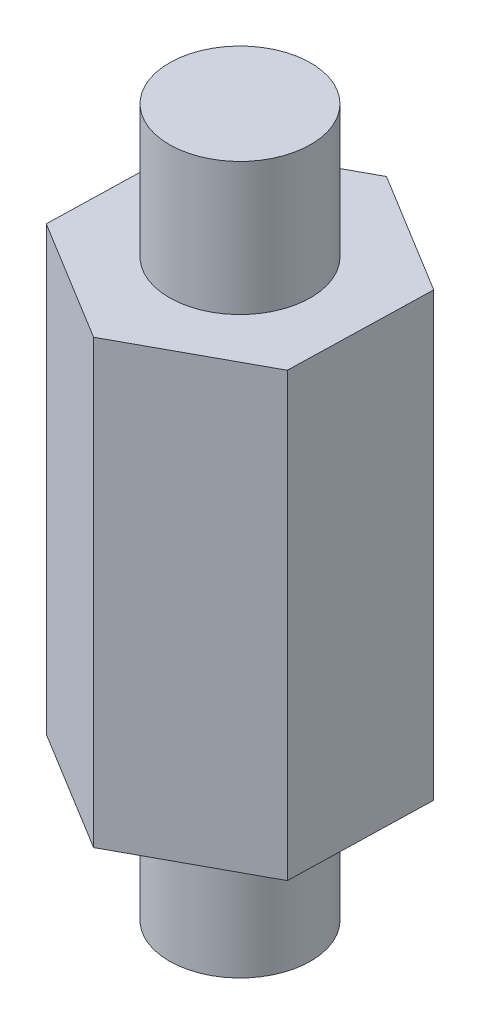
from build123d import *

# Parameters (mm, degrees)
SKETCH_1_R      = 1.6
EXTRUDE_1_DEPTH = 3
EXTRUDE_2_DEPTH = 10
SKETCH_3_R      = 1.6
EXTRUDE_3_DEPTH = 3


with BuildPart() as part:
    # 草图1 → 凸台-拉伸1 (new body)
    with BuildSketch(Plane(origin=(0, 0, 0), x_dir=(1, 0, 0), z_dir=(0, 1, 0))):
        with Locations(Location((0, 0, 0), (0, 0, 270))):
            Circle(SKETCH_1_R)
    extrude(amount=EXTRUDE_1_DEPTH)

    # 草图2 → 凸台-拉伸2 (add)
    with BuildSketch(Plane(origin=(0, 3, 0), x_dir=(1, 0, 0), z_dir=(0, 1, 0))):
        Polygon((2.757018897, -1.686460265), (2.839026881, 1.544418271), (0.082007983, 3.230878536), (-2.757018897, 1.686460265), (-2.839026881, -1.544418271), (-0.082007983, -3.230878536), align=None)
    extrude(amount=EXTRUDE_2_DEPTH)

    # 草图3 → 凸台-拉伸3 (add)
    with BuildSketch(Plane(origin=(0, 13, 0), x_dir=(1, 0, 0), z_dir=(0, 1, 0))):
        with Locations(Location((0, 0, 0), (0, 0, 270))):
            Circle(SKETCH_3_R)
    extrude(amount=EXTRUDE_3_DEPTH)


solid = part.part
